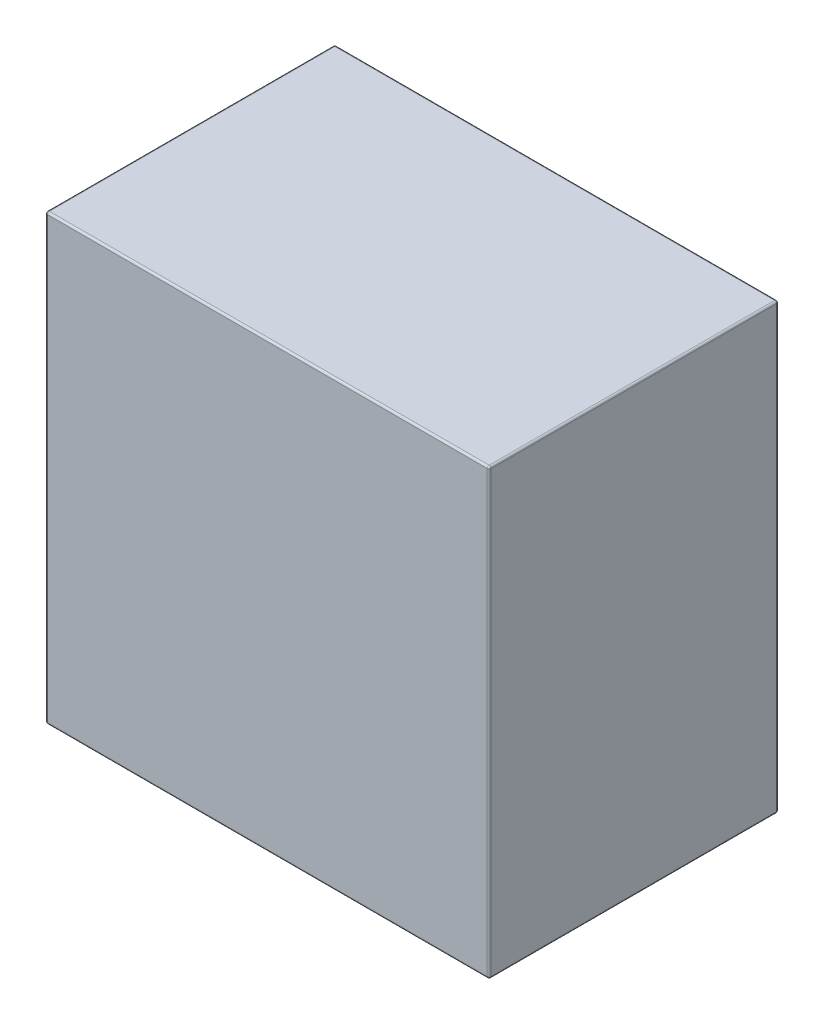
from build123d import *

# Parameters (mm, degrees)
SKETCH1_W           = 23
SKETCH1_H           = 23
BOSS_EXTRUDE1_DEPTH = 15
FILLET1_R           = 0.1


with BuildPart() as part:
    # Sketch1 → Boss-Extrude1 (new body)
    with BuildSketch(Plane(origin=(0, 0, 0), x_dir=(0, 1, 0), z_dir=(0, 0, 1))):
        Rectangle(SKETCH1_W, SKETCH1_H)
    extrude(amount=BOSS_EXTRUDE1_DEPTH)

    # Fillet1
    fillet1_edges = [part.edges().sort_by_distance(p)[0] for p in [
        (0, -11.5, 15),
        (11.5, 0, 15),
        (0, 11.5, 15),
        (11.5, 0, 0),
        (0, -11.5, 0),
        (-11.5, 0, 0),
        (0, 11.5, 0),
        (11.5, 11.5, 7.5),
        (11.5, -11.5, 7.5),
        (-11.5, -11.5, 7.5),
        (-11.5, 11.5, 7.5),
        (-11.5, 0, 15),
    ]]
    fillet(fillet1_edges, radius=FILLET1_R)


solid = part.part
